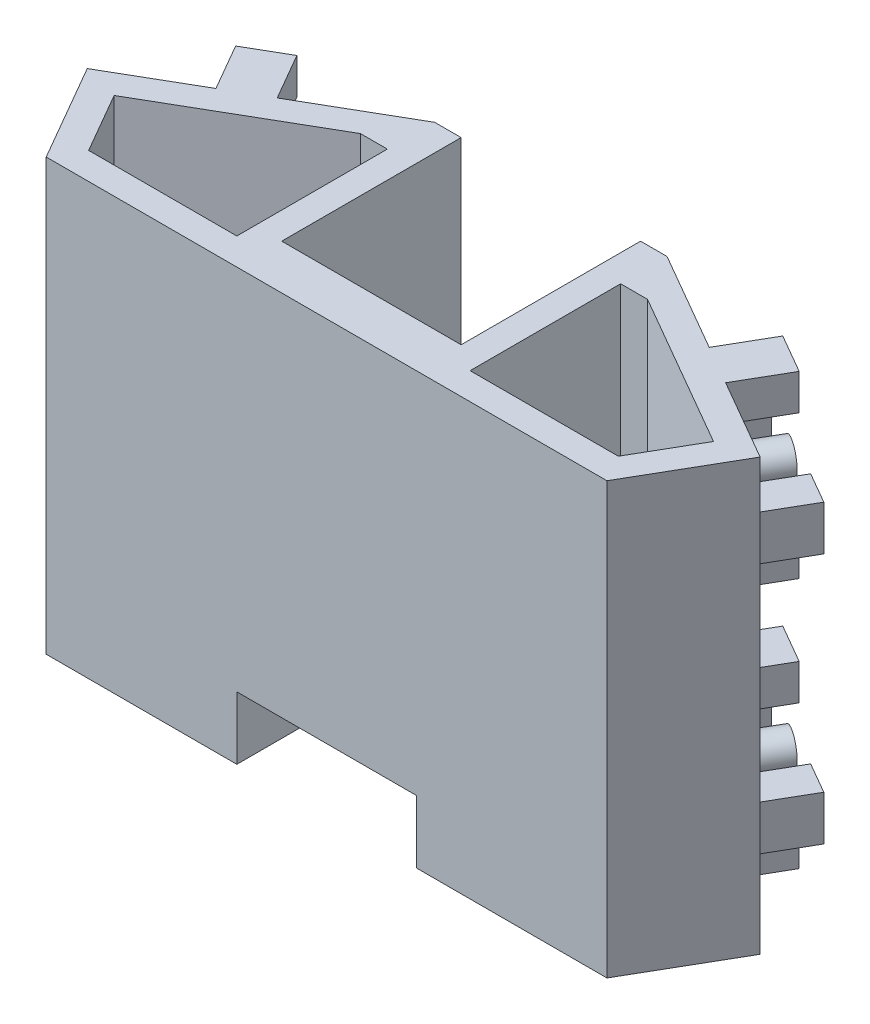
from build123d import *

# Parameters (mm, degrees)
BOSS_EXTRU_1_DEPTH          = 48
ENL_V_MAT_EXTRU_1_REACH     = 67.843
BOSS_EXTRU_2_DEPTH          = 48
ESQUISSE3_R                 = 1.9
ESQUISSE3_W                 = 5
ESQUISSE3_H                 = 4
ESQUISSE3_W_2               = 4
ESQUISSE3_H_2               = 5
BOSS_EXTRU_3_DEPTH          = 6
SYM_TRIE3_COPY_1_SKETCH_R   = 1.9
SYM_TRIE3_COPY_1_SKETCH_W   = 5
SYM_TRIE3_COPY_1_SKETCH_H   = 4
SYM_TRIE3_COPY_1_SKETCH_W_2 = 4
SYM_TRIE3_COPY_1_SKETCH_H_2 = 5
SYM_TRIE3_COPY_1_DEPTH      = 6
ESQUISSE5_W                 = 20
ESQUISSE5_H                 = 5
ENL_V_MAT_EXTRU_2_DEPTH     = 7


with BuildPart() as part:
    # Esquisse1 → Boss.-Extru.1 (new body)
    with BuildSketch(Plane(origin=(0, 0, 0), x_dir=(1, 0, 0), z_dir=(0, 1, 0))):
        Polygon((-31.25, 0), (31.25, 0), (37.5, 10.825317547), (12.948729811, 25), (10, 25), (10, 5), (-10, 5), (-10, 25), (-12.948729811, 25), (-37.5, 10.825317547), align=None)
    extrude(amount=BOSS_EXTRU_1_DEPTH)

    # Esquisse2 → Enlèv. mat.-Extru.1 (cut, up to next)
    with BuildSketch(Plane(origin=(0, 48, 0), x_dir=(1, 0, 0), z_dir=(0, 1, 0)), mode=Mode.PRIVATE) as enl_v_mat_extru_1_sk1:
        Polygon((-36, 8.227241336), (-16, 19.77424672), (-13, 19.77424672), (-13, 0), (-31.25, 0), align=None)
    enl_v_mat_extru_1_tool1 = extrude(enl_v_mat_extru_1_sk1.sketch, amount=-ENL_V_MAT_EXTRU_1_REACH, mode=Mode.PRIVATE) & part.part
    enl_v_mat_extru_1 = enl_v_mat_extru_1_tool1.solids().sort_by_distance((-22.148909, 48, -8.14347))[0]
    add(enl_v_mat_extru_1, mode=Mode.SUBTRACT)

    # Symétrie1: Enlèv. mat.-Extru.1 across plane
    add(enl_v_mat_extru_1.mirror(Plane(origin=(0, 0, 0), x_dir=(0, 0, 1), z_dir=(1, 0, 0))), mode=Mode.SUBTRACT)

    # Esquisse4 → Boss.-Extru.2 (add)
    with BuildSketch(Plane(origin=(0, 0, 0), x_dir=(1, 0, 0), z_dir=(0, 1, 0))):
        Polygon((-37.5, 10.825317547), (-31.25, 0), (31.25, 0), (37.5, 10.825317547), (34.901923789, 12.325317547), (29.517949192, 3), (-29.517949192, 3), (-34.901923789, 12.325317547), align=None)
    extrude(amount=BOSS_EXTRU_2_DEPTH)

    # Esquisse3 → Boss.-Extru.3 (add)
    with BuildSketch(Plane(origin=(-14.0625, 0, -24.356964481), x_dir=(0.8660254037844396, 0, -0.4999999999999984), z_dir=(0.49999999999999833, 0, 0.8660254037844395))):
        with Locations((-14.063293868, 38)):
            Circle(ESQUISSE3_R)
        with Locations((-14.063293868, 46)):
            Rectangle(ESQUISSE3_W, ESQUISSE3_H)
        with Locations((-22.063293868, 38)):
            Rectangle(ESQUISSE3_W_2, ESQUISSE3_H_2)
        with Locations((-6.063293868, 38)):
            Rectangle(ESQUISSE3_W_2, ESQUISSE3_H_2)
        with Locations((-14.063293868, 30)):
            Rectangle(ESQUISSE3_W, ESQUISSE3_H)
    boss_extru_3 = extrude(amount=-BOSS_EXTRU_3_DEPTH)

    # Symétrie2: Boss.-Extru.3 across plane
    add(boss_extru_3.mirror(Plane.ZX.offset(24)))

    # Symétrie3: Boss.-Extru.3 across plane
    add(boss_extru_3.mirror(Plane(origin=(0, 0, 0), x_dir=(0, 0, 1), z_dir=(1, 0, 0))))

    # Symétrie3 copy 1 sketch → Symétrie3 copy 1 (add)
    with BuildSketch(Plane(origin=(14.0625, 48, -24.356964481), x_dir=(-0.8660254037844396, 0, -0.4999999999999984), z_dir=(-0.49999999999999833, 0, 0.8660254037844395))):
        with Locations((-14.063293868, 38)):
            Circle(SYM_TRIE3_COPY_1_SKETCH_R)
        with Locations((-14.063293868, 46)):
            Rectangle(SYM_TRIE3_COPY_1_SKETCH_W, SYM_TRIE3_COPY_1_SKETCH_H)
        with Locations((-22.063293868, 38)):
            Rectangle(SYM_TRIE3_COPY_1_SKETCH_W_2, SYM_TRIE3_COPY_1_SKETCH_H_2)
        with Locations((-6.063293868, 38)):
            Rectangle(SYM_TRIE3_COPY_1_SKETCH_W_2, SYM_TRIE3_COPY_1_SKETCH_H_2)
        with Locations((-14.063293868, 30)):
            Rectangle(SYM_TRIE3_COPY_1_SKETCH_W, SYM_TRIE3_COPY_1_SKETCH_H)
    extrude(amount=-SYM_TRIE3_COPY_1_DEPTH)

    # Esquisse5 → Enlèv. mat.-Extru.2 (cut)
    with BuildSketch(Plane(origin=(0, 0, 0), x_dir=(1, 0, 0), z_dir=(0, 1, 0))):
        with Locations((0, 2.5)):
            Rectangle(ESQUISSE5_W, ESQUISSE5_H)
    extrude(amount=ENL_V_MAT_EXTRU_2_DEPTH, mode=Mode.SUBTRACT)


solid = part.part
